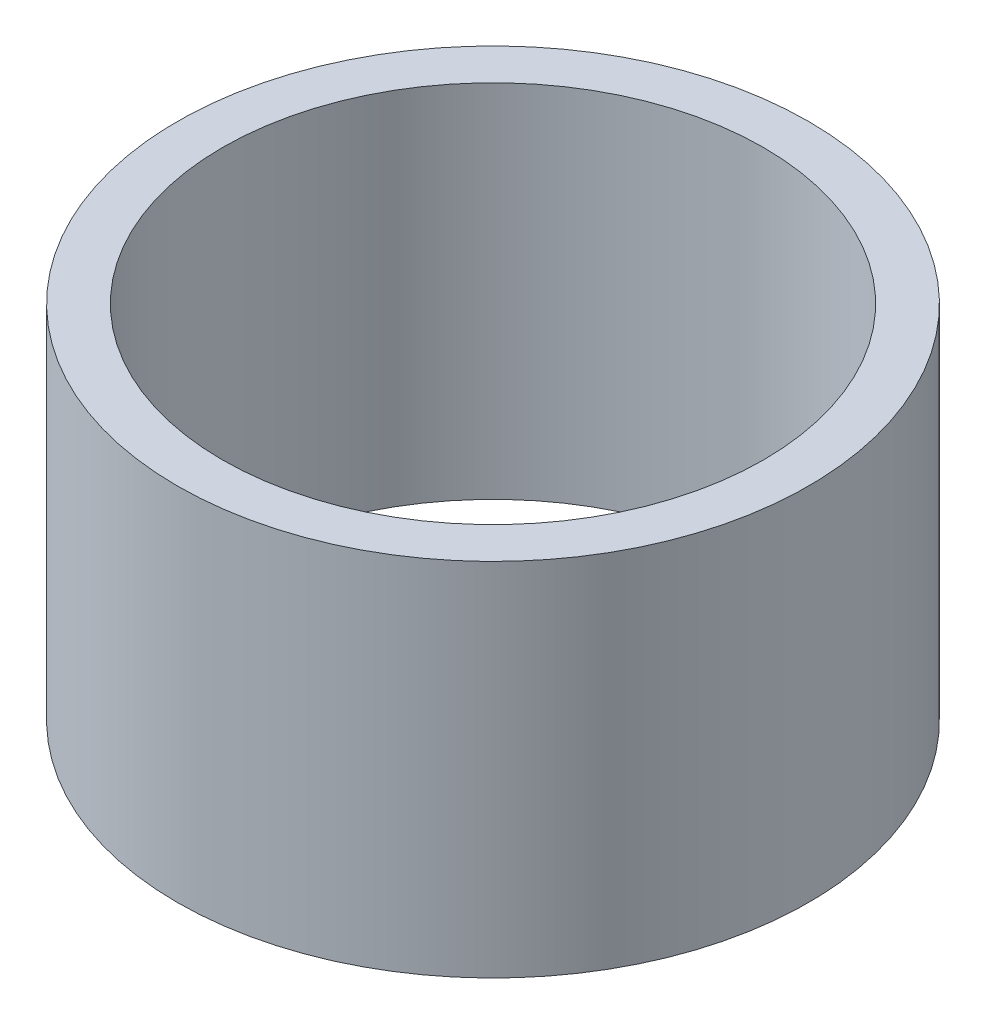
from build123d import *

# Parameters (mm, degrees)
SKETCH1_R           = 22.225
BOSS_EXTRUDE1_DEPTH = 25.4
SKETCH4_R           = 19.05
CUT_EXTRUDE1_DEPTH  = 41.411152545


with BuildPart() as part:
    # Sketch1 → Boss-Extrude1 (new body)
    with BuildSketch(Plane(origin=(0, 0, 0), x_dir=(1, 0, 0), z_dir=(0, 1, 0))):
        with Locations(Location((0, 0, 0), (0, 0, 270))):
            Circle(SKETCH1_R)
    extrude(amount=BOSS_EXTRUDE1_DEPTH)

    # Sketch4 → Cut-Extrude1 (cut, through all)
    with BuildSketch(Plane(origin=(0, 25.4, 0), x_dir=(1, 0, 0), z_dir=(0, 1, 0))):
        with Locations(Location((0, 0, 0), (0, 0, 270))):
            Circle(SKETCH4_R)
    extrude(amount=-CUT_EXTRUDE1_DEPTH, mode=Mode.SUBTRACT)


solid = part.part
